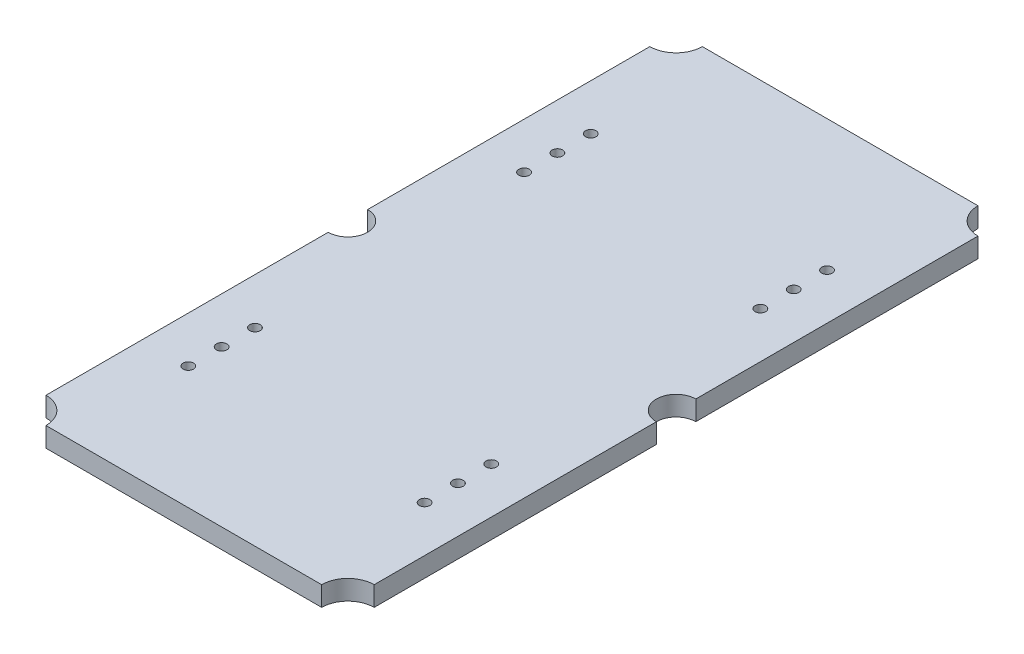
from build123d import *

# Parameters (mm, degrees)
SKETCH_1_W          = 25
SKETCH_1_H          = 50
EXTRUDE_1_DEPTH     = 1.5
SKETCH_2_R          = 1.5
SKETCH_2_R_2        = 2
SKETCH_2_R_3        = 0.4
CUT_EXTRUDE_1_DEPTH = 56.921820428


with BuildPart() as part:
    # Эскиз1 → Бобышка-Вытянуть1 (new body)
    with BuildSketch(Plane(origin=(0, 0, 0), x_dir=(1, 0, 0), z_dir=(0, 1, 0))):
        with Locations((12.5, 25)):
            Rectangle(SKETCH_1_W, SKETCH_1_H)
    extrude(amount=EXTRUDE_1_DEPTH)

    # Эскиз2 → Вырез-Вытянуть1 (cut, through all)
    with BuildSketch(Plane(origin=(0, 1.5, 0), x_dir=(1, 0, 0), z_dir=(0, 1, 0))):
        with Locations((25, 25)):
            Circle(SKETCH_2_R)
        with Locations((0, 25)):
            Circle(SKETCH_2_R)
        with Locations((25, 0)):
            Circle(SKETCH_2_R_2)
        Circle(SKETCH_2_R_2)
        with Locations((0, 50)):
            Circle(SKETCH_2_R_2)
        with Locations((25, 50)):
            Circle(SKETCH_2_R_2)
        with Locations(Location((3.5, 40, 0), (0, 0, 270))):
            Circle(SKETCH_2_R_3)
        with Locations(Location((3.5, 37.46, 0), (0, 0, 270))):
            Circle(SKETCH_2_R_3)
        with Locations(Location((3.5, 34.92, 0), (0, 0, 270))):
            Circle(SKETCH_2_R_3)
        with Locations(Location((3.5, 14.42, 0), (0, 0, 270))):
            Circle(SKETCH_2_R_3)
        with Locations(Location((3.5, 11.88, 0), (0, 0, 270))):
            Circle(SKETCH_2_R_3)
        with Locations(Location((3.5, 9.34, 0), (0, 0, 270))):
            Circle(SKETCH_2_R_3)
        with Locations(Location((21.5, 40, 0), (0, 0, 270))):
            Circle(SKETCH_2_R_3)
        with Locations(Location((21.5, 37.46, 0), (0, 0, 270))):
            Circle(SKETCH_2_R_3)
        with Locations(Location((21.5, 34.92, 0), (0, 0, 270))):
            Circle(SKETCH_2_R_3)
        with Locations(Location((21.5, 14.42, 0), (0, 0, 270))):
            Circle(SKETCH_2_R_3)
        with Locations(Location((21.5, 11.88, 0), (0, 0, 270))):
            Circle(SKETCH_2_R_3)
        with Locations(Location((21.5, 9.34, 0), (0, 0, 270))):
            Circle(SKETCH_2_R_3)
    extrude(amount=-CUT_EXTRUDE_1_DEPTH, mode=Mode.SUBTRACT)


solid = part.part
